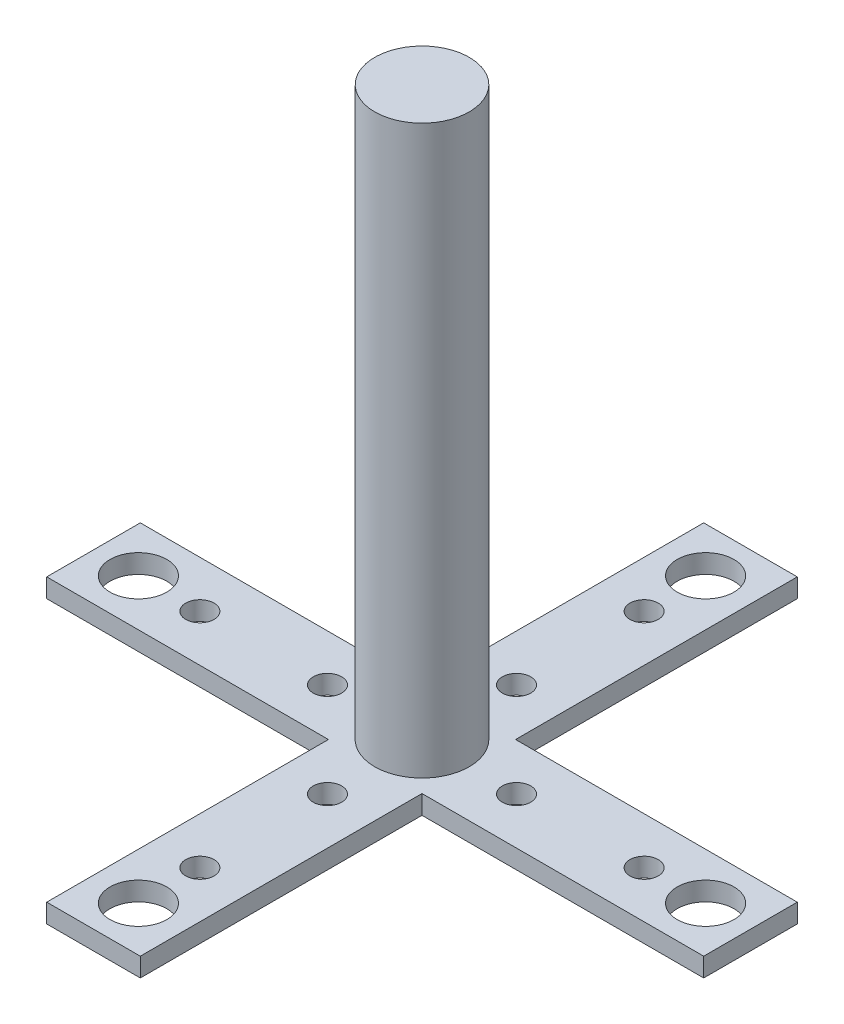
from build123d import *

# Parameters (mm, degrees)
SKETCH_2_W          = 69.5
SKETCH_2_H          = 9.9
SKETCH_2_R          = 1.5
SKETCH_2_W_2        = 9.9
SKETCH_2_H_2        = 69.5
EXTRUDE_5_DEPTH     = 2
SKETCH_4_R          = 5
EXTRUDE_8_DEPTH     = 60
SKETCH_6_R          = 3
CUT_EXTRUDE_1_DEPTH = 80.114632022


with BuildPart() as part:
    # 草图2 → 凸台-拉伸5 (new body)
    # profile 1 of 2: a face of its own
    with BuildSketch(Plane(origin=(0, 0, 0), x_dir=(1, 0, 0), z_dir=(0, 1, 0))):
        Rectangle(SKETCH_2_W, SKETCH_2_H)
        with Locations(Location((23.5, 0, 0), (0, 0, 270))):
            Circle(SKETCH_2_R, mode=Mode.SUBTRACT)
        with Locations(Location((10, 0, 0), (0, 0, 270))):
            Circle(SKETCH_2_R, mode=Mode.SUBTRACT)
        with Locations(Location((-23.5, 0, 0), (0, 0, 270))):
            Circle(SKETCH_2_R, mode=Mode.SUBTRACT)
        with Locations(Location((-10, 0, 0), (0, 0, 270))):
            Circle(SKETCH_2_R, mode=Mode.SUBTRACT)
    # profile 2 of 2: a face of its own
    with BuildSketch(Plane(origin=(0, 0, 0), x_dir=(1, 0, 0), z_dir=(0, 1, 0))):
        Rectangle(SKETCH_2_W_2, SKETCH_2_H_2)
        with Locations(Location((0, 10, 0), (0, 0, 270))):
            Circle(SKETCH_2_R, mode=Mode.SUBTRACT)
        with Locations(Location((0, 23.5, 0), (0, 0, 270))):
            Circle(SKETCH_2_R, mode=Mode.SUBTRACT)
        with Locations(Location((0, -23.5, 0), (0, 0, 270))):
            Circle(SKETCH_2_R, mode=Mode.SUBTRACT)
        with Locations(Location((0, -10, 0), (0, 0, 270))):
            Circle(SKETCH_2_R, mode=Mode.SUBTRACT)
    extrude(amount=EXTRUDE_5_DEPTH)

    # 草图4 → 凸台-拉伸8 (add)
    with BuildSketch(Plane(origin=(0, 2, 0), x_dir=(1, 0, 0), z_dir=(0, 1, 0))):
        with Locations(Location((0, 0, 0), (0, 0, 270))):
            Circle(SKETCH_4_R)
    extrude(amount=EXTRUDE_8_DEPTH)

    # 草图6 → 切除-拉伸1 (cut, through all)
    with BuildSketch(Plane.XZ):
        with Locations(Location((0, -30, 0), (0, 0, 270))):
            Circle(SKETCH_6_R)
        with Locations(Location((-30, 0, 0), (0, 0, 270))):
            Circle(SKETCH_6_R)
        with Locations(Location((0, 30, 0), (0, 0, 270))):
            Circle(SKETCH_6_R)
        with Locations(Location((30, 0, 0), (0, 0, 270))):
            Circle(SKETCH_6_R)
    extrude(amount=-CUT_EXTRUDE_1_DEPTH, mode=Mode.SUBTRACT)


solid = part.part
